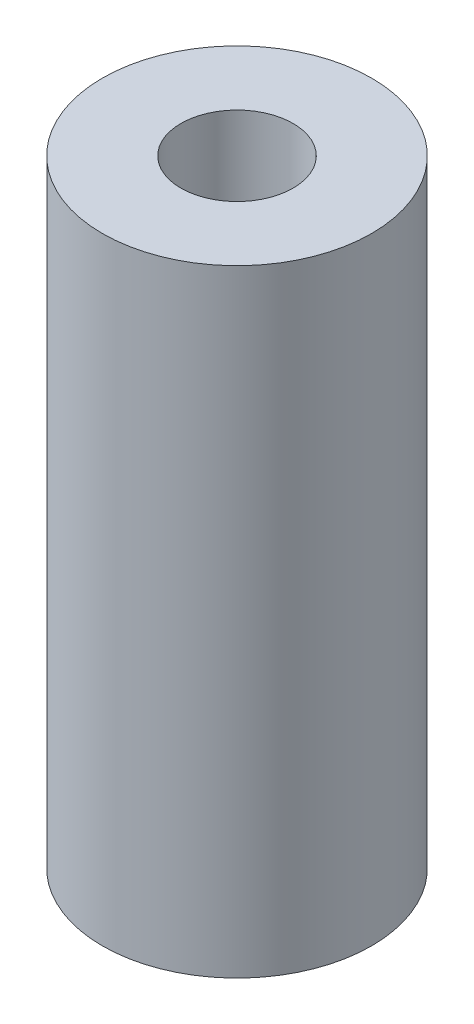
from build123d import *

# Parameters (mm, degrees)
SKETCH1_R           = 6
SKETCH1_R_2         = 2.5
BOSS_EXTRUDE1_DEPTH = 27.5


with BuildPart() as part:
    # Sketch1 → Boss-Extrude1 (new body)
    with BuildSketch(Plane(origin=(0, 0, 0), x_dir=(1, 0, 0), z_dir=(0, 1, 0))):
        with Locations(Location((0, 0, 0), (0, 0, 270))):
            Circle(SKETCH1_R)
        with Locations(Location((0, 0, 0), (0, 0, 270))):
            Circle(SKETCH1_R_2, mode=Mode.SUBTRACT)
    extrude(amount=BOSS_EXTRUDE1_DEPTH)


solid = part.part
